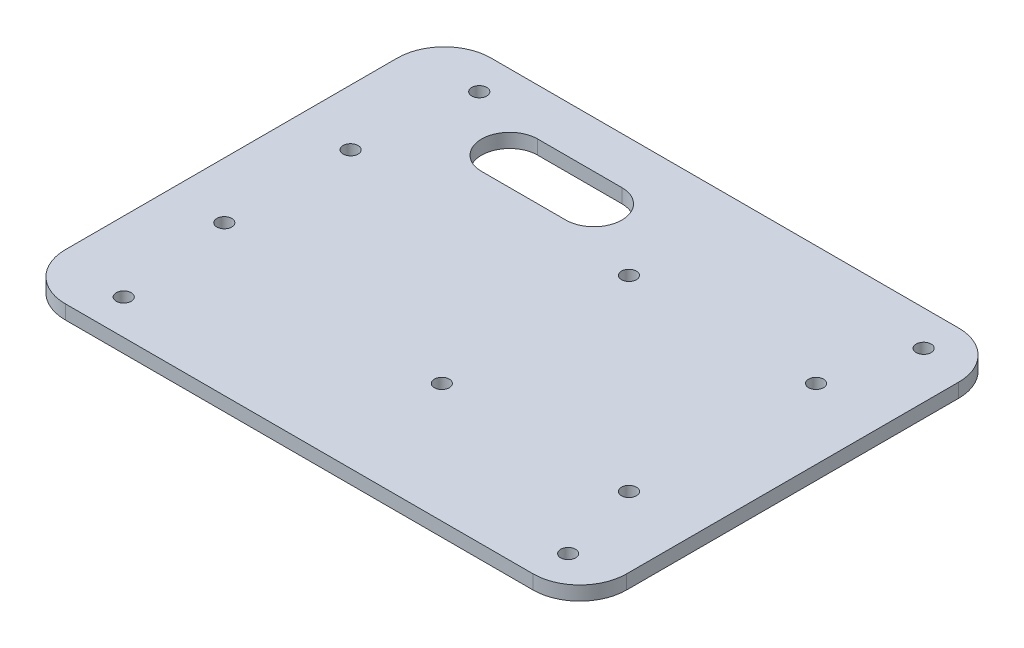
from build123d import *

# Parameters (mm, degrees)
Y_KSEKLIK_EKSTR_ZYON1_DEPTH = 3
IZIM2_R                     = 1.6
KES_EKSTR_ZYON1_DEPTH       = 3
IZIM3_R                     = 1.6
KES_EKSTR_ZYON2_DEPTH       = 3
KES_EKSTR_ZYON3_DEPTH       = 3
IZIM5_R                     = 1.6
KES_EKSTR_ZYON4_DEPTH       = 3


with BuildPart() as part:
    # Çizim1 → Yükseklik-Ekstrüzyon1 (new body)
    with BuildSketch(Plane(origin=(0, 0, 0), x_dir=(1, 0, 0), z_dir=(0, 1, 0))):
        with BuildLine():
            Line((-50, -45.5), (50, -45.5))
            ThreePointArc((50, -45.5), (57.071067812, -42.571067812), (60, -35.5))
            Line((60, -35.5), (60, 35.5))
            ThreePointArc((60, 35.5), (57.071067812, 42.571067812), (50, 45.5))
            Line((50, 45.5), (-50, 45.5))
            ThreePointArc((-50, 45.5), (-57.071067812, 42.571067812), (-60, 35.5))
            Line((-60, 35.5), (-60, -35.5))
            ThreePointArc((-60, -35.5), (-57.071067812, -42.571067812), (-50, -45.5))
        make_face()
    extrude(amount=Y_KSEKLIK_EKSTR_ZYON1_DEPTH)

    # Çizim2 → Kes-Ekstrüzyon1 (cut)
    with BuildSketch(Plane(origin=(0, 3, 0), x_dir=(1, 0, 0), z_dir=(0, 1, 0))):
        with Locations(Location((50, -38, 0), (0, 0, 270))):
            Circle(IZIM2_R)
        with Locations(Location((50, 38, 0), (0, 0, 270))):
            Circle(IZIM2_R)
        with Locations(Location((-45, 38, 0), (0, 0, 270))):
            Circle(IZIM2_R)
        with Locations(Location((-45, -38, 0), (0, 0, 270))):
            Circle(IZIM2_R)
    extrude(amount=-KES_EKSTR_ZYON1_DEPTH, mode=Mode.SUBTRACT)

    # Çizim3 → Kes-Ekstrüzyon2 (cut)
    with BuildSketch(Plane(origin=(0, 3, 0), x_dir=(1, 0, 0), z_dir=(0, 1, 0))):
        with Locations(Location((45, 20, 0), (0, 0, 270))):
            Circle(IZIM3_R)
        with Locations(Location((45, -20, 0), (0, 0, 270))):
            Circle(IZIM3_R)
        with Locations(Location((5, 20, 0), (0, 0, 270))):
            Circle(IZIM3_R)
        with Locations(Location((5, -20, 0), (0, 0, 270))):
            Circle(IZIM3_R)
    extrude(amount=-KES_EKSTR_ZYON2_DEPTH, mode=Mode.SUBTRACT)

    # Çizim4 → Kes-Ekstrüzyon3 (cut)
    with BuildSketch(Plane(origin=(0, 3, 0), x_dir=(1, 0, 0), z_dir=(0, 1, 0))):
        with BuildLine():
            Line((-30, 35.5), (-12, 35.5))
            ThreePointArc((-12, 35.5), (-6, 29.5), (-12, 23.5))
            Line((-12, 23.5), (-30, 23.5))
            ThreePointArc((-30, 23.5), (-36, 29.5), (-30, 35.5))
        make_face()
    extrude(amount=-KES_EKSTR_ZYON3_DEPTH, mode=Mode.SUBTRACT)

    # Çizim5 → Kes-Ekstrüzyon4 (cut)
    with BuildSketch(Plane(origin=(0, 3, 0), x_dir=(1, 0, 0), z_dir=(0, 1, 0))):
        with Locations(Location((-48, 13.5, 0), (0, 0, 270))):
            Circle(IZIM5_R)
        with Locations(Location((-48, -13.5, 0), (0, 0, 270))):
            Circle(IZIM5_R)
    extrude(amount=-KES_EKSTR_ZYON4_DEPTH, mode=Mode.SUBTRACT)


solid = part.part
